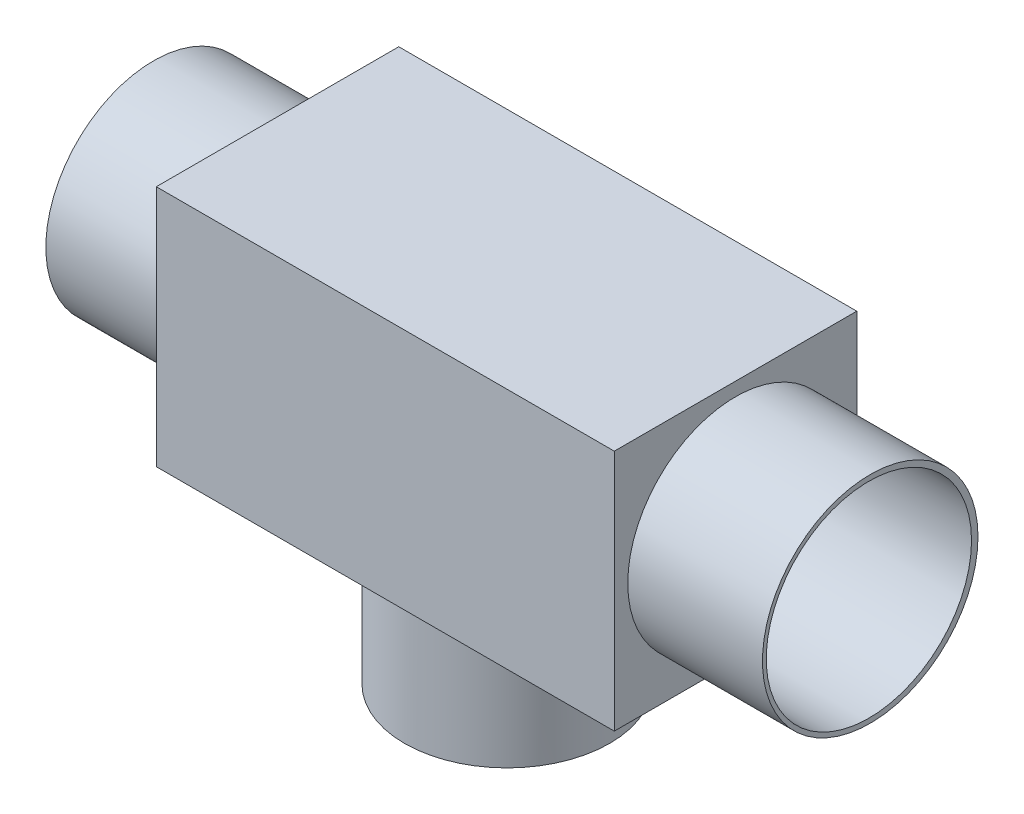
from build123d import *

# Parameters (mm, degrees)
CROQUIS1_W                   = 85
CROQUIS1_H                   = 45
SALIENTE_EXTRUIR1_DEPTH      = 45
SALIENTE_EXTRUIR2_DEPTH      = 25
SALIENTE_EXTRUIR2_DEPTH_BACK = 108
CROQUIS2_R                   = 20
CROQUIS7_R                   = 19.05
SALIENTE_EXTRUIR3_DEPTH      = 25
CROQUIS10_R                  = 16.961855078
CORTAR_EXTRUIR2_DEPTH        = 45
CROQUIS12_R                  = 19.05
CORTAR_EXTRUIR3_DEPTH        = 159


with BuildPart() as part:
    # Croquis1 → Saliente-Extruir1 (new body)
    with BuildSketch(Plane.XY):
        Rectangle(CROQUIS1_W, CROQUIS1_H)
    extrude(amount=SALIENTE_EXTRUIR1_DEPTH)

    # Croquis2 → Saliente-Extruir2 (add, two sides: drawn at the far end of the back side and taken through both)
    with BuildSketch(Plane(origin=(42.5, 0, 0), x_dir=(0, 0, -1), z_dir=(1, 0, 0)).offset(-SALIENTE_EXTRUIR2_DEPTH_BACK)):
        with Locations((-22.5, 0)):
            Circle(CROQUIS2_R)
    extrude(amount=SALIENTE_EXTRUIR2_DEPTH + SALIENTE_EXTRUIR2_DEPTH_BACK)

    # Croquis7 → Saliente-Extruir3 (add)
    with BuildSketch(Plane.XZ.offset(22.5)):
        with Locations(Location((0, 22.39581729, 0), (0, 0, 180))):
            Circle(CROQUIS7_R)
    extrude(amount=SALIENTE_EXTRUIR3_DEPTH)

    # Croquis10 → Cortar-Extruir2 (cut)
    with BuildSketch(Plane(origin=(0, -47.5, 0), x_dir=(-1, 0, 0), z_dir=(0, -1, 0))):
        with Locations(Location((0, -22.64581729, 0), (0, 0, 180))):
            Circle(CROQUIS10_R)
    extrude(amount=-CORTAR_EXTRUIR2_DEPTH, mode=Mode.SUBTRACT)

    # Croquis12 → Cortar-Extruir3 (cut)
    with BuildSketch(Plane(origin=(67.5, 0, 0), x_dir=(0, 0, -1), z_dir=(1, 0, 0))):
        with Locations((-22.75, 0)):
            Circle(CROQUIS12_R)
    extrude(amount=-CORTAR_EXTRUIR3_DEPTH, mode=Mode.SUBTRACT)


solid = part.part
